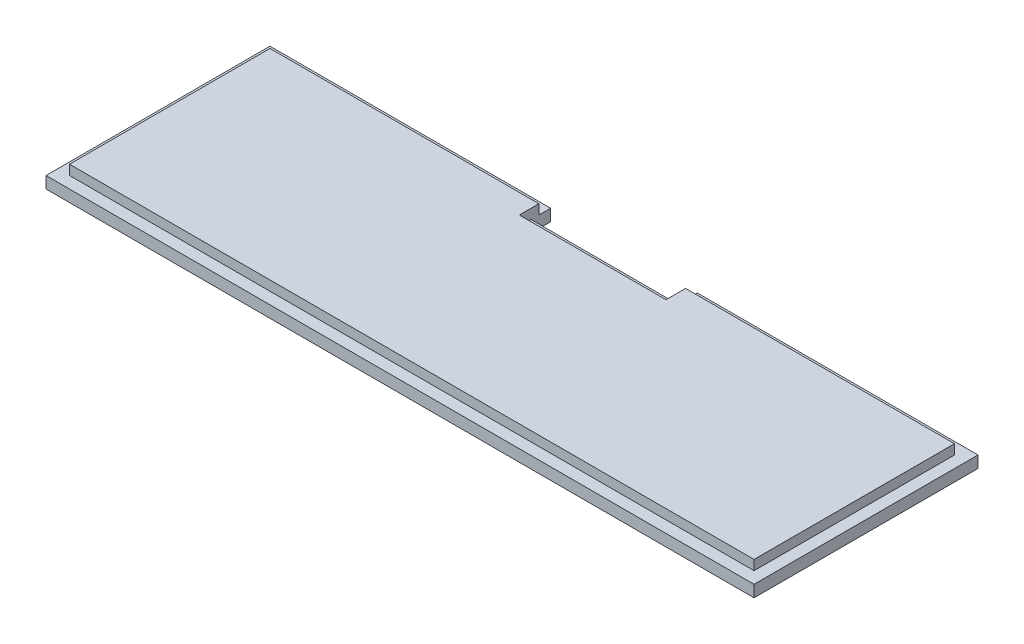
from build123d import *

# Parameters (mm, degrees)
SKICA1_W                 = 72.4
SKICA1_H                 = 22.9
P_IDAT_VYSUNUT_M2_DEPTH  = 1.2
SKICA2_W                 = 70
SKICA2_H                 = 20.5
P_IDAT_VYSUNUT_M3_DEPTH  = 1
SKICA3_W                 = 15
SKICA3_H                 = 2
ODEBRAT_VYSUNUT_M1_DEPTH = 10
SKICA4_W                 = 15
SKICA4_H                 = 1.2
ODEBRAT_VYSUNUT_M2_DEPTH = 1


with BuildPart() as part:
    # Skica1 → Přidat vysunutím2 (new body)
    with BuildSketch(Plane(origin=(0, 0, 0), x_dir=(1, 0, 0), z_dir=(0, 1, 0))):
        with Locations((36.2, 11.45)):
            Rectangle(SKICA1_W, SKICA1_H)
    extrude(amount=P_IDAT_VYSUNUT_M2_DEPTH)

    # Skica2 → Přidat vysunutím3 (add)
    with BuildSketch(Plane(origin=(0, 1.2, 0), x_dir=(1, 0, 0), z_dir=(0, 1, 0))):
        with Locations((36.2, 11.45)):
            Rectangle(SKICA2_W, SKICA2_H)
    extrude(amount=P_IDAT_VYSUNUT_M3_DEPTH)

    # Skica3 → Odebrat vysunutím1 (cut)
    with BuildSketch(Plane(origin=(0, 2.2, 0), x_dir=(1, 0, 0), z_dir=(0, 1, 0))):
        with Locations((36.2, 21.9)):
            Rectangle(SKICA3_W, SKICA3_H)
    extrude(amount=-ODEBRAT_VYSUNUT_M1_DEPTH, mode=Mode.SUBTRACT)

    # Skica4 → Odebrat vysunutím2 (cut)
    with BuildSketch(Plane(origin=(0, 2.2, 0), x_dir=(1, 0, 0), z_dir=(0, 1, 0))):
        with Locations((36.2, 20.3)):
            Rectangle(SKICA4_W, SKICA4_H)
    extrude(amount=-ODEBRAT_VYSUNUT_M2_DEPTH, mode=Mode.SUBTRACT)


solid = part.part
